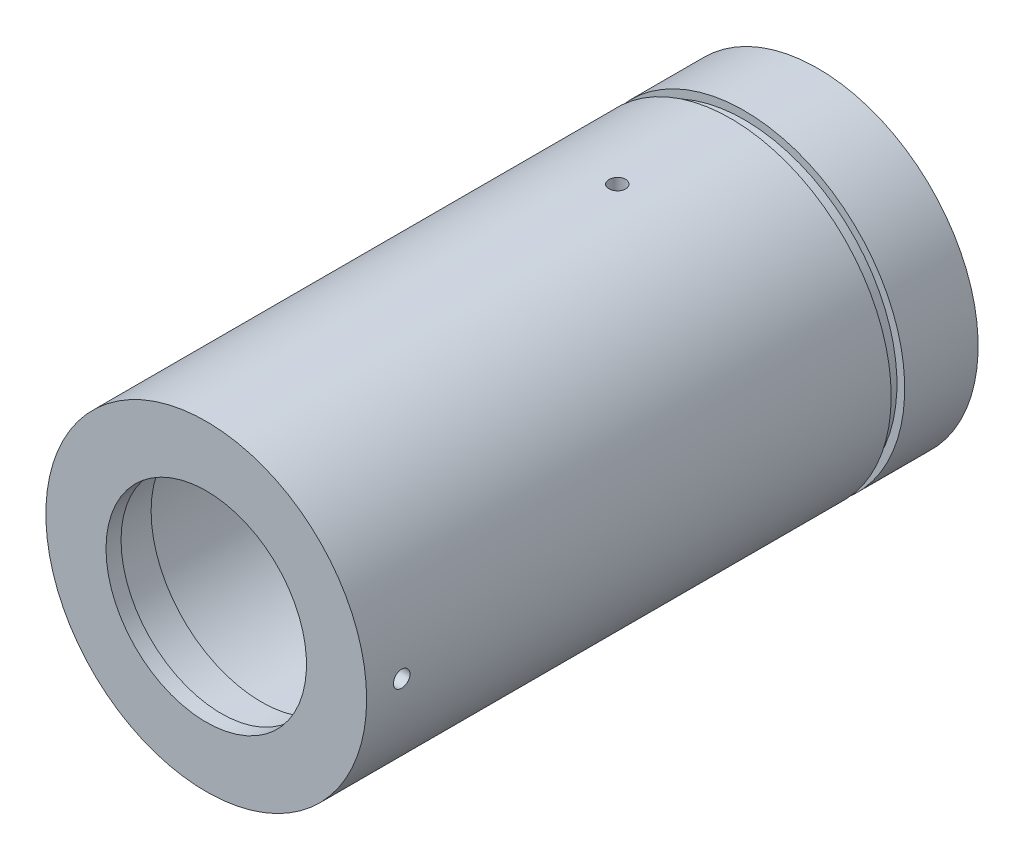
from build123d import *

# Parameters (mm, degrees)
SKETCH1_R            = 32
BODY_DEPTH           = 122
SKETCH2_R            = 20
LIP_BORE_DEPTH       = 122
SKETCH3_R            = 22
BRIDGE_SEAT_DEPTH    = 119
SKETCH4_R            = 25
HOPPER_DEPTH         = 111
SKETCH5_R            = 27
BURR_SEAT_DEPTH      = 50
SKETCH6_R            = 28
PILOT_SEAT_DEPTH     = 30
SKETCH7_R            = 28.46
THREAD_MINOR_DEPTH   = 10
SKETCH8_R            = 29.5
THREAD_RELIEF_DEPTH  = 2
SKETCH9_R            = 33
SKETCH9_R_2          = 30.45
ORING_GROOVE_DEPTH   = 2.7
SKETCH10_R           = 1.65
BURR_SCREW_90_DEPTH  = 6
SKETCH11_R           = 1.65
BURR_SCREW_270_DEPTH = 6
SKETCH12_R           = 1.65
BRIDGE_SCREW_DEPTH   = 11
SKETCH13_R           = 2.5
PLUNGER_HOLE_DEPTH   = 5


with BuildPart() as part:
    # Sketch1 → Body (new body)
    with BuildSketch(Plane.XY):
        with Locations(Location((0, 0, 0), (0, 0, 180))):
            Circle(SKETCH1_R)
    extrude(amount=BODY_DEPTH)

    # Sketch2 → Lip_bore (cut)
    with BuildSketch(Plane.XY):
        with Locations(Location((0, 0, 0), (0, 0, 180))):
            Circle(SKETCH2_R)
    extrude(amount=LIP_BORE_DEPTH, mode=Mode.SUBTRACT)

    # Sketch3 → Bridge_seat (cut)
    with BuildSketch(Plane.XY):
        with Locations(Location((0, 0, 0), (0, 0, 180))):
            Circle(SKETCH3_R)
    extrude(amount=BRIDGE_SEAT_DEPTH, mode=Mode.SUBTRACT)

    # Sketch4 → Hopper (cut)
    with BuildSketch(Plane.XY):
        Circle(SKETCH4_R)
    extrude(amount=HOPPER_DEPTH, mode=Mode.SUBTRACT)

    # Sketch5 → Burr_seat (cut)
    with BuildSketch(Plane.XY):
        Circle(SKETCH5_R)
    extrude(amount=BURR_SEAT_DEPTH, mode=Mode.SUBTRACT)

    # Sketch6 → Pilot_seat (cut)
    with BuildSketch(Plane.XY):
        Circle(SKETCH6_R)
    extrude(amount=PILOT_SEAT_DEPTH, mode=Mode.SUBTRACT)

    # Sketch7 → Thread_minor (cut)
    with BuildSketch(Plane.XY):
        Circle(SKETCH7_R)
    extrude(amount=THREAD_MINOR_DEPTH, mode=Mode.SUBTRACT)

    # Sketch8 → Thread_relief (cut)
    with BuildSketch(Plane.XY.offset(10)):
        Circle(SKETCH8_R)
    extrude(amount=THREAD_RELIEF_DEPTH, mode=Mode.SUBTRACT)

    # Sketch9 → Oring_groove (cut)
    with BuildSketch(Plane.XY.offset(14.65)):
        Circle(SKETCH9_R)
        with Locations(Location((0, 0, 0), (0, 0, 180))):
            Circle(SKETCH9_R_2, mode=Mode.SUBTRACT)
    extrude(amount=ORING_GROOVE_DEPTH, mode=Mode.SUBTRACT)

    # Sketch10 → Burr_screw_90 (cut)
    with BuildSketch(Plane(origin=(0, 26.5, 0), x_dir=(1, 0, 0), z_dir=(0, 1, 0))):
        with Locations(Location((0, -40, 0), (0, 0, 90))):
            Circle(SKETCH10_R)
    extrude(amount=BURR_SCREW_90_DEPTH, mode=Mode.SUBTRACT)

    # Sketch11 → Burr_screw_270 (cut)
    with BuildSketch(Plane(origin=(0, -32.5, 0), x_dir=(1, 0, 0), z_dir=(0, 1, 0))):
        with Locations(Location((0, -40, 0), (0, 0, 90))):
            Circle(SKETCH11_R)
    extrude(amount=BURR_SCREW_270_DEPTH, mode=Mode.SUBTRACT)

    # Sketch12 → Bridge_screw (cut)
    with BuildSketch(Plane(origin=(21.5, 0, 0), x_dir=(0, 0, -1), z_dir=(1, 0, 0))):
        with Locations(Location((-115, 0, 0), (0, 0, 180))):
            Circle(SKETCH12_R)
    extrude(amount=BRIDGE_SCREW_DEPTH, mode=Mode.SUBTRACT)

    # Sketch13 → Plunger_hole (cut)
    with BuildSketch(Plane(origin=(-32.5, 0, 0), x_dir=(0, 0, -1), z_dir=(1, 0, 0))):
        with Locations(Location((-22, 0, 0), (0, 0, 180))):
            Circle(SKETCH13_R)
    extrude(amount=PLUNGER_HOLE_DEPTH, mode=Mode.SUBTRACT)


solid = part.part
